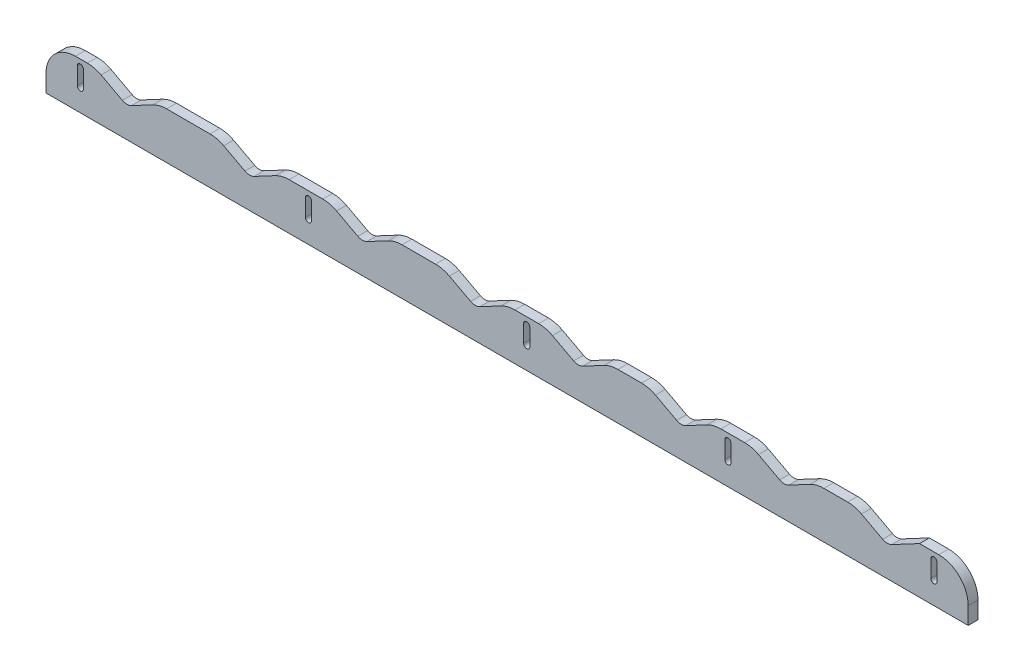
from build123d import *

# Parameters (mm, degrees)
RESSALTO_EXTRUS_O1_DEPTH = 20


with BuildPart() as part:
    # Esboço1 → Ressalto-extrusão1 (new body)
    # profile 1 of 2: a face of its own
    with BuildSketch(Plane.XY):
        with BuildLine():
            Line((-938.823833844, -27.471849847), (-938.823833844, -32.471849847))
            Line((-938.823833844, -32.471849847), (-936.823833844, -32.471849847))
            Line((-936.823833844, -32.471849847), (941.176166156, -32.471849847))
            Line((941.176166156, -32.471849847), (941.176166156, -27.471849847))
            ThreePointArc((941.176166156, -27.471849847), (923.602573027, 14.954557024), (881.176166156, 32.528150153))
            Line((881.176166156, 32.528150153), (846.261701379, 32.528150153))
            Line((846.261701379, 32.528150153), (842.001592443, 32.528150153))
            Line((842.001592443, 32.528150153), (785.565597412, 2.52059931))
            ThreePointArc((785.565597412, 2.52059931), (776.176166156, 0.179551167), (766.7867349, 2.52059931))
            Line((766.7867349, 2.52059931), (723.559353465, 25.505005725))
            ThreePointArc((723.559353465, 25.505005725), (709.906373434, 30.74589373), (695.391059698, 32.528150153))
            Line((695.391059698, 32.528150153), (646.961272614, 32.528150153))
            ThreePointArc((646.961272614, 32.528150153), (632.445958878, 30.74589373), (618.792978847, 25.505005725))
            Line((618.792978847, 25.505005725), (575.565597412, 2.52059931))
            ThreePointArc((575.565597412, 2.52059931), (566.176166156, 0.179551167), (556.7867349, 2.52059931))
            Line((556.7867349, 2.52059931), (513.559353465, 25.505005725))
            ThreePointArc((513.559353465, 25.505005725), (499.906373434, 30.74589373), (485.391059698, 32.528150153))
            Line((485.391059698, 32.528150153), (436.961272614, 32.528150153))
            ThreePointArc((436.961272614, 32.528150153), (422.445958878, 30.74589373), (408.792978847, 25.505005725))
            Line((408.792978847, 25.505005725), (365.565597412, 2.52059931))
            ThreePointArc((365.565597412, 2.52059931), (356.176166156, 0.179551167), (346.7867349, 2.52059931))
            Line((346.7867349, 2.52059931), (303.559353465, 25.505005725))
            ThreePointArc((303.559353465, 25.505005725), (289.906373434, 30.74589373), (275.391059698, 32.528150153))
            Line((275.391059698, 32.528150153), (226.961272614, 32.528150153))
            ThreePointArc((226.961272614, 32.528150153), (212.445958878, 30.74589373), (198.792978847, 25.505005725))
            Line((198.792978847, 25.505005725), (155.565597412, 2.52059931))
            ThreePointArc((155.565597412, 2.52059931), (146.176166156, 0.179551167), (136.7867349, 2.52059931))
            Line((136.7867349, 2.52059931), (93.559353465, 25.505005725))
            ThreePointArc((93.559353465, 25.505005725), (79.906373434, 30.74589373), (65.391059698, 32.528150153))
            Line((65.391059698, 32.528150153), (16.961272614, 32.528150153))
            ThreePointArc((16.961272614, 32.528150153), (2.445958878, 30.74589373), (-11.207021153, 25.505005725))
            Line((-11.207021153, 25.505005725), (-54.434402588, 2.52059931))
            ThreePointArc((-54.434402588, 2.52059931), (-63.823833844, 0.179551167), (-73.2132651, 2.52059931))
            Line((-73.2132651, 2.52059931), (-116.440646535, 25.505005725))
            ThreePointArc((-116.440646535, 25.505005725), (-130.093626566, 30.74589373), (-144.608940302, 32.528150153))
            Line((-144.608940302, 32.528150153), (-213.038727386, 32.528150153))
            ThreePointArc((-213.038727386, 32.528150153), (-227.554041122, 30.74589373), (-241.207021153, 25.505005725))
            Line((-241.207021153, 25.505005725), (-284.434402588, 2.52059931))
            ThreePointArc((-284.434402588, 2.52059931), (-293.823833844, 0.179551167), (-303.2132651, 2.52059931))
            Line((-303.2132651, 2.52059931), (-346.440646535, 25.505005725))
            ThreePointArc((-346.440646535, 25.505005725), (-360.093626566, 30.74589373), (-374.608940302, 32.528150153))
            Line((-374.608940302, 32.528150153), (-443.038727386, 32.528150153))
            ThreePointArc((-443.038727386, 32.528150153), (-457.554041122, 30.74589373), (-471.207021153, 25.505005725))
            Line((-471.207021153, 25.505005725), (-514.434402588, 2.52059931))
            ThreePointArc((-514.434402588, 2.52059931), (-523.823833844, 0.179551167), (-533.2132651, 2.52059931))
            Line((-533.2132651, 2.52059931), (-576.440646535, 25.505005725))
            ThreePointArc((-576.440646535, 25.505005725), (-590.093626566, 30.74589373), (-604.608940302, 32.528150153))
            Line((-604.608940302, 32.528150153), (-693.038727386, 32.528150153))
            ThreePointArc((-693.038727386, 32.528150153), (-707.554041122, 30.74589373), (-721.207021153, 25.505005725))
            Line((-721.207021153, 25.505005725), (-764.434402588, 2.52059931))
            ThreePointArc((-764.434402588, 2.52059931), (-773.823833844, 0.179551167), (-783.2132651, 2.52059931))
            Line((-783.2132651, 2.52059931), (-826.440646535, 25.505005725))
            ThreePointArc((-826.440646535, 25.505005725), (-840.093626566, 30.74589373), (-854.608940302, 32.528150153))
            Line((-854.608940302, 32.528150153), (-878.823833844, 32.528150153))
            ThreePointArc((-878.823833844, 32.528150153), (-921.250240715, 14.954557024), (-938.823833844, -27.471849847))
        make_face()
        with BuildLine():
            ThreePointArc((-875.073833844, 17.528150153), (-868.823833844, 23.778150153), (-862.573833844, 17.528150153))
            Line((-862.573833844, 17.528150153), (-862.573833844, -17.471849847))
            ThreePointArc((-862.573833844, -17.471849847), (-868.823833844, -23.721849847), (-875.073833844, -17.471849847))
            Line((-875.073833844, -17.471849847), (-875.073833844, 17.528150153))
        make_face(mode=Mode.SUBTRACT)
        with BuildLine():
            ThreePointArc((-410.073833844, 17.528150153), (-403.823833844, 23.778150153), (-397.573833844, 17.528150153))
            Line((-397.573833844, 17.528150153), (-397.573833844, -17.471849847))
            ThreePointArc((-397.573833844, -17.471849847), (-403.823833844, -23.721849847), (-410.073833844, -17.471849847))
            Line((-410.073833844, -17.471849847), (-410.073833844, 17.528150153))
        make_face(mode=Mode.SUBTRACT)
        with BuildLine():
            ThreePointArc((47.426166156, -17.471849847), (41.176166156, -23.721849847), (34.926166156, -17.471849847))
            Line((34.926166156, -17.471849847), (34.926166156, 17.528150153))
            ThreePointArc((34.926166156, 17.528150153), (41.176166156, 23.778150153), (47.426166156, 17.528150153))
            Line((47.426166156, 17.528150153), (47.426166156, -17.471849847))
        make_face(mode=Mode.SUBTRACT)
        with BuildLine():
            ThreePointArc((444.926166156, 17.528150153), (451.176166156, 23.778150153), (457.426166156, 17.528150153))
            Line((457.426166156, 17.528150153), (457.426166156, -17.471849847))
            ThreePointArc((457.426166156, -17.471849847), (451.176166156, -23.721849847), (444.926166156, -17.471849847))
            Line((444.926166156, -17.471849847), (444.926166156, 17.528150153))
        make_face(mode=Mode.SUBTRACT)
        with BuildLine():
            ThreePointArc((877.426166156, -17.471849847), (871.176166156, -23.721849847), (864.926166156, -17.471849847))
            Line((864.926166156, -17.471849847), (864.926166156, 17.528150153))
            ThreePointArc((864.926166156, 17.528150153), (871.176166156, 23.778150153), (877.426166156, 17.528150153))
            Line((877.426166156, 17.528150153), (877.426166156, -17.471849847))
        make_face(mode=Mode.SUBTRACT)
    # profile 2 of 2: a face of its own
    with BuildSketch(Plane.XY):
        Polygon((-936.823833844, -32.471849847), (-938.823833844, -32.471849847), (-938.823833844, -62.471849847), (941.176166156, -62.471849847), (941.176166156, -32.471849847), align=None)
    extrude(amount=RESSALTO_EXTRUS_O1_DEPTH)


solid = part.part
